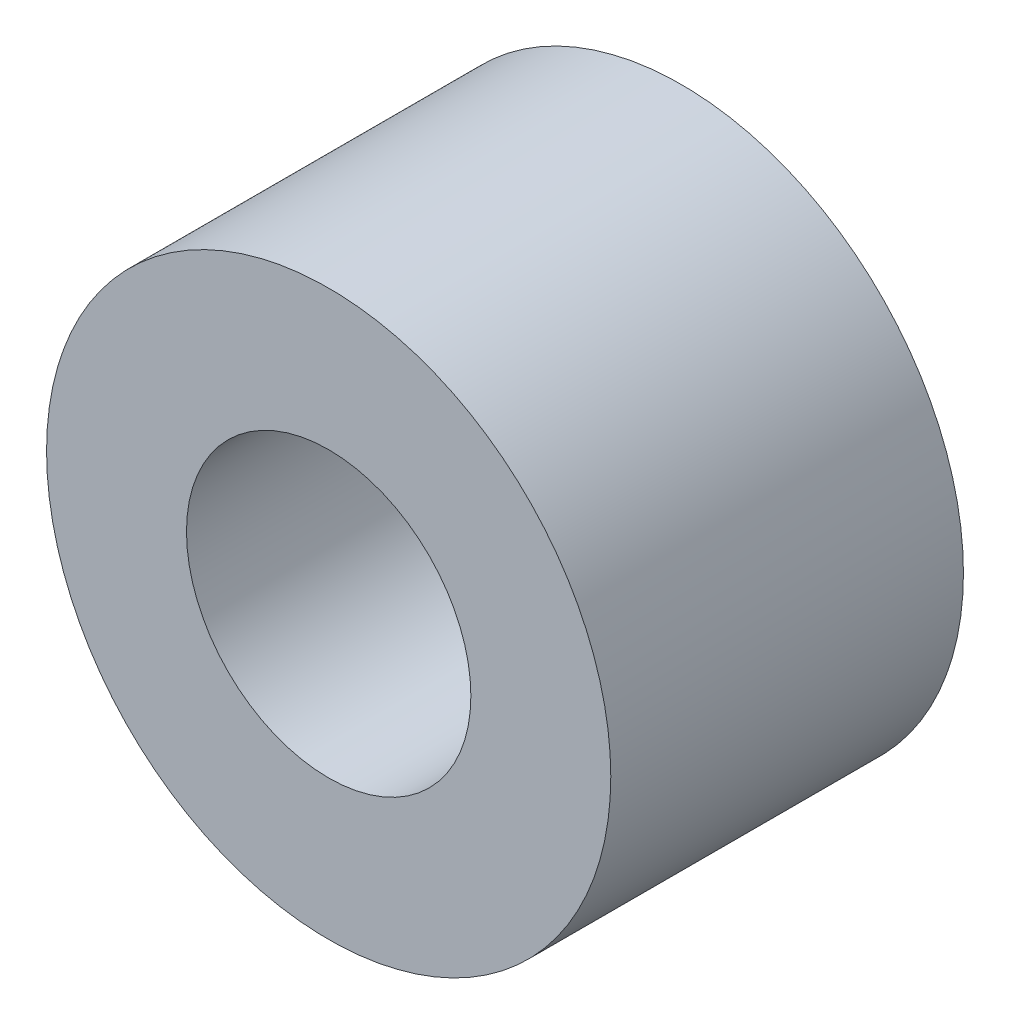
from build123d import *

# Parameters (mm, degrees)
SKETCH1_R      = 6.35
SKETCH1_R_2    = 3.2004
EXTRUDE1_DEPTH = 3.96875


with BuildPart() as part:
    # Sketch1 → Extrude1 (new, symmetric)
    with BuildSketch(Plane.XY):
        Circle(SKETCH1_R)
        Circle(SKETCH1_R_2, mode=Mode.SUBTRACT)
    extrude(amount=EXTRUDE1_DEPTH, both=True)


solid = part.part
